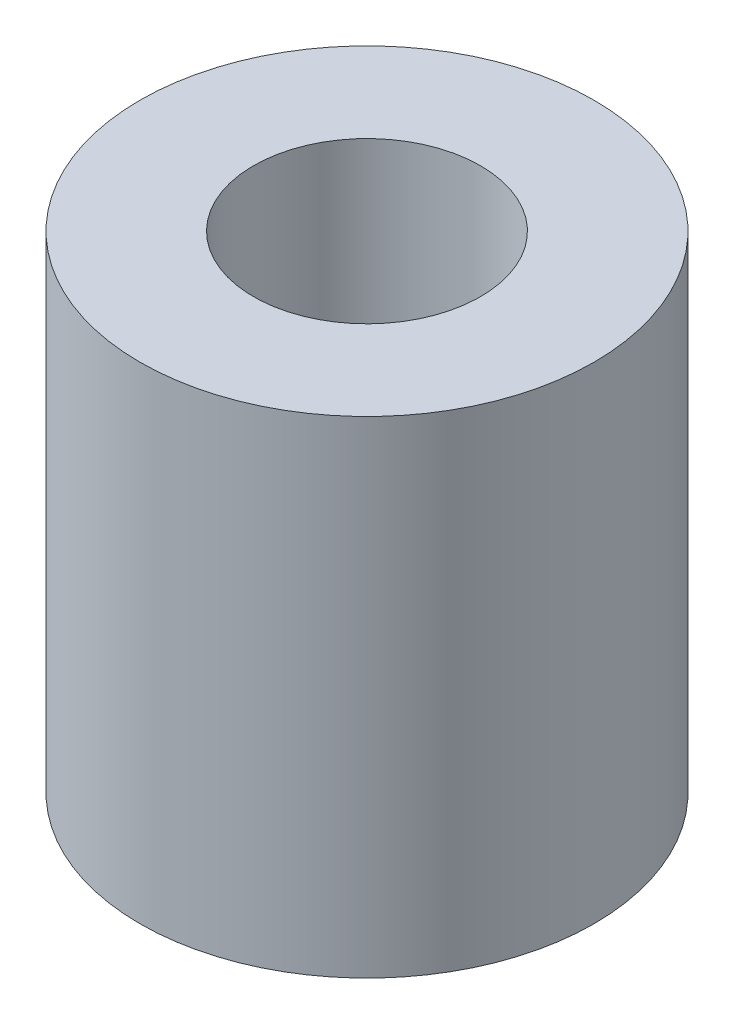
from build123d import *

# Parameters (mm, degrees)
SKETCH1_W = 7
SKETCH1_H = 30


with BuildPart() as part:
    # Sketch1 → Revolve1 (revolve)
    with BuildSketch(Plane.XY, mode=Mode.PRIVATE) as revolve1_sk:
        with Locations((-10.5, 15)):
            Rectangle(SKETCH1_W, SKETCH1_H)
    revolve(revolve1_sk.sketch.rotate(Axis((0, 0, 0), (0, 1, 0)), 270), axis=Axis((0, 0, 0), (0, 1, 0)))


solid = part.part
